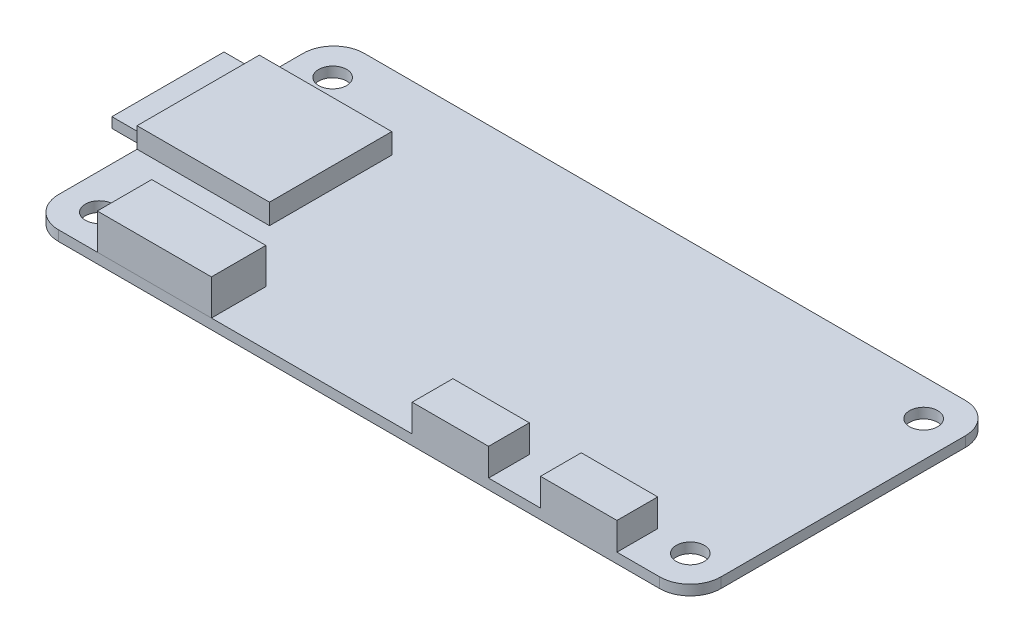
from build123d import *

# Parameters (mm, degrees)
SKETCH_1_R      = 1.375
EXTRUDE_1_DEPTH = 1
SKETCH_2_W      = 7.5
SKETCH_2_H      = 4
EXTRUDE_2_DEPTH = 2.7
SKETCH_3_W      = 11.2
SKETCH_3_H      = 5.343091965
EXTRUDE_3_DEPTH = 3.5
SKETCH_4_W      = 13
SKETCH_4_H      = 12
EXTRUDE_4_DEPTH = 2
SKETCH_5_W      = 16
SKETCH_5_H      = 11
EXTRUDE_5_DEPTH = 1


with BuildPart() as part:
    # 草图1 → 凸台-拉伸1 (new body)
    with BuildSketch(Plane(origin=(0, 0, 0), x_dir=(1, 0, 0), z_dir=(0, 1, 0))):
        with BuildLine():
            Line((-32.5, 12), (-32.5, -12))
            ThreePointArc((-32.5, -12), (-31.621320344, -14.121320344), (-29.5, -15))
            Line((-29.5, -15), (29.5, -15))
            ThreePointArc((29.5, -15), (31.621320344, -14.121320344), (32.5, -12))
            Line((32.5, -12), (32.5, 12))
            ThreePointArc((32.5, 12), (31.621320344, 14.121320344), (29.5, 15))
            Line((29.5, 15), (-29.5, 15))
            ThreePointArc((-29.5, 15), (-31.621320344, 14.121320344), (-32.5, 12))
        make_face()
        with Locations(Location((29, 11.4, 0), (0, 0, 270))):
            Circle(SKETCH_1_R, mode=Mode.SUBTRACT)
        with Locations(Location((29, -11.5, 0), (0, 0, 270))):
            Circle(SKETCH_1_R, mode=Mode.SUBTRACT)
        with Locations(Location((-29, -11.5, 0), (0, 0, 270))):
            Circle(SKETCH_1_R, mode=Mode.SUBTRACT)
        with Locations(Location((-29, 11.4, 0), (0, 0, 270))):
            Circle(SKETCH_1_R, mode=Mode.SUBTRACT)
    extrude(amount=EXTRUDE_1_DEPTH)

    # 草图2 → 凸台-拉伸2 (add)
    with BuildSketch(Plane(origin=(0, 1, 0), x_dir=(1, 0, 0), z_dir=(0, 1, 0))):
        with Locations((21.55, -13)):
            Rectangle(SKETCH_2_W, SKETCH_2_H)
        with Locations((8.95, -13)):
            Rectangle(SKETCH_2_W, SKETCH_2_H)
    extrude(amount=EXTRUDE_2_DEPTH)


with BuildPart() as body_2:
    # 草图3 → 凸台-拉伸3 (new body)
    with BuildSketch(Plane(origin=(0, 1, 0), x_dir=(1, 0, 0), z_dir=(0, 1, 0))):
        with Locations((-20.1, -12.328454018)):
            Rectangle(SKETCH_3_W, SKETCH_3_H)
    extrude(amount=EXTRUDE_3_DEPTH)


with BuildPart() as body_3:
    # 草图4 → 凸台-拉伸4 (new body)
    with BuildSketch(Plane(origin=(0, 1, 0), x_dir=(1, 0, 0), z_dir=(0, 1, 0))):
        with Locations((-26, 1.7)):
            Rectangle(SKETCH_4_W, SKETCH_4_H)
    extrude(amount=EXTRUDE_4_DEPTH)

    # 草图5 → 凸台-拉伸5 (add)
    with BuildSketch(Plane(origin=(0, 1, 0), x_dir=(1, 0, 0), z_dir=(0, 1, 0))):
        with Locations((-27.5, 1.732869615)):
            Rectangle(SKETCH_5_W, SKETCH_5_H)
    extrude(amount=EXTRUDE_5_DEPTH)


solid = Compound([part.part, body_2.part, body_3.part])
